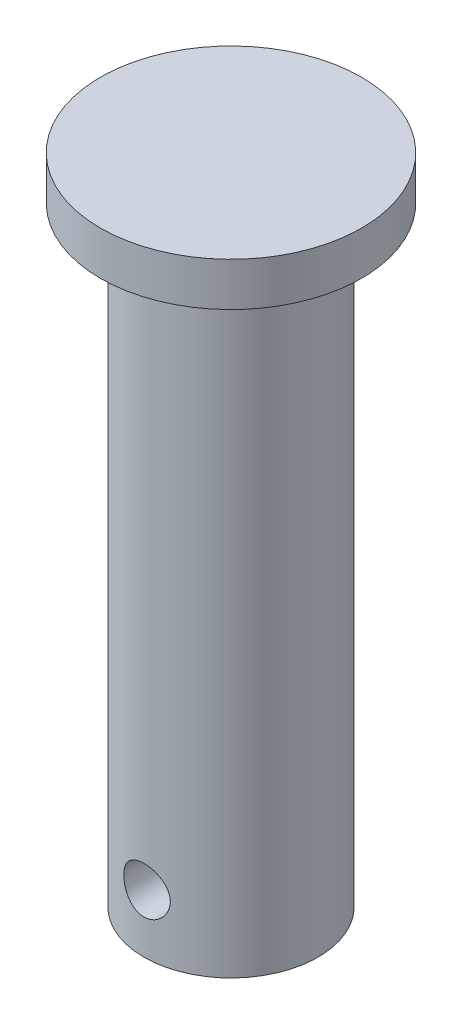
from build123d import *

# Parameters (mm, degrees)
SKETCH1_R               = 6
BOSS_EXTRUDE1_DEPTH     = 42
SKETCH2_R               = 9
BOSS_EXTRUDE2_DEPTH     = 3
CUT_EXTRUDE1_DEPTH      = 47.765371804
CUT_EXTRUDE1_DEPTH_BACK = 47.765371804
SKETCH3_R               = 1.6


with BuildPart() as part:
    # Sketch1 → Boss-Extrude1 (new body)
    with BuildSketch(Plane(origin=(0, 0, 0), x_dir=(1, 0, 0), z_dir=(0, 1, 0))):
        with Locations(Location((0, 0, 0), (0, 0, 90))):
            Circle(SKETCH1_R)
    extrude(amount=BOSS_EXTRUDE1_DEPTH)

    # Sketch2 → Boss-Extrude2 (add)
    with BuildSketch(Plane(origin=(0, 42, 0), x_dir=(1, 0, 0), z_dir=(0, 1, 0))):
        with Locations(Location((0, 0, 0), (0, 0, 270))):
            Circle(SKETCH2_R)
    extrude(amount=BOSS_EXTRUDE2_DEPTH)

    # Sketch3 → Cut-Extrude1 (cut, two sides: drawn at the far end of the back side and taken through both)
    with BuildSketch(Plane.XY.offset(-CUT_EXTRUDE1_DEPTH_BACK)):
        with Locations(Location((0, 4, 0), (0, 0, 89.999999978))):
            Circle(SKETCH3_R)
    extrude(amount=CUT_EXTRUDE1_DEPTH + CUT_EXTRUDE1_DEPTH_BACK, mode=Mode.SUBTRACT)


solid = part.part
